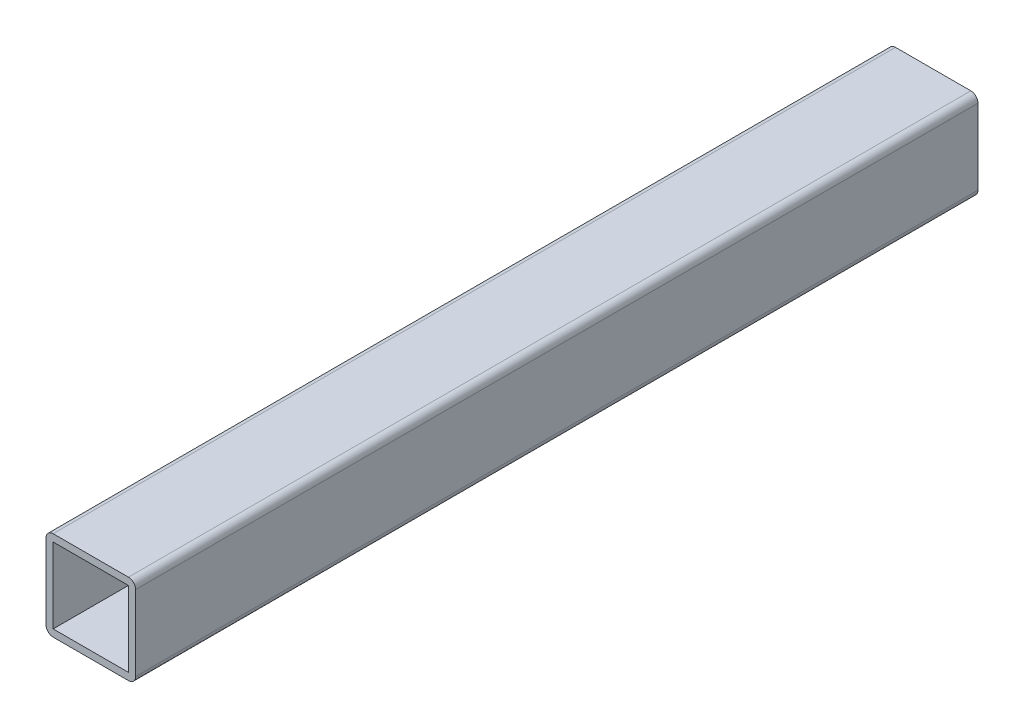
from build123d import *

# Parameters (mm, degrees)
SKETCH_1_W      = 42
SKETCH_1_H      = 42
EXTRUDE_1_DEPTH = 470


with BuildPart() as part:
    # Эскиз1 → Бобышка-Вытянуть1 (new body)
    with BuildSketch(Plane.XY):
        with BuildLine():
            Line((4, 0), (46, 0))
            ThreePointArc((46, 0), (48.828427125, 1.171572875), (50, 4))
            Line((50, 4), (50, 46))
            ThreePointArc((50, 46), (48.828427125, 48.828427125), (46, 50))
            Line((46, 50), (4, 50))
            ThreePointArc((4, 50), (1.171572875, 48.828427125), (0, 46))
            Line((0, 46), (0, 4))
            ThreePointArc((0, 4), (1.171572875, 1.171572875), (4, 0))
        make_face()
        with Locations((25, 25)):
            Rectangle(SKETCH_1_W, SKETCH_1_H, mode=Mode.SUBTRACT)
    extrude(amount=EXTRUDE_1_DEPTH)


solid = part.part
